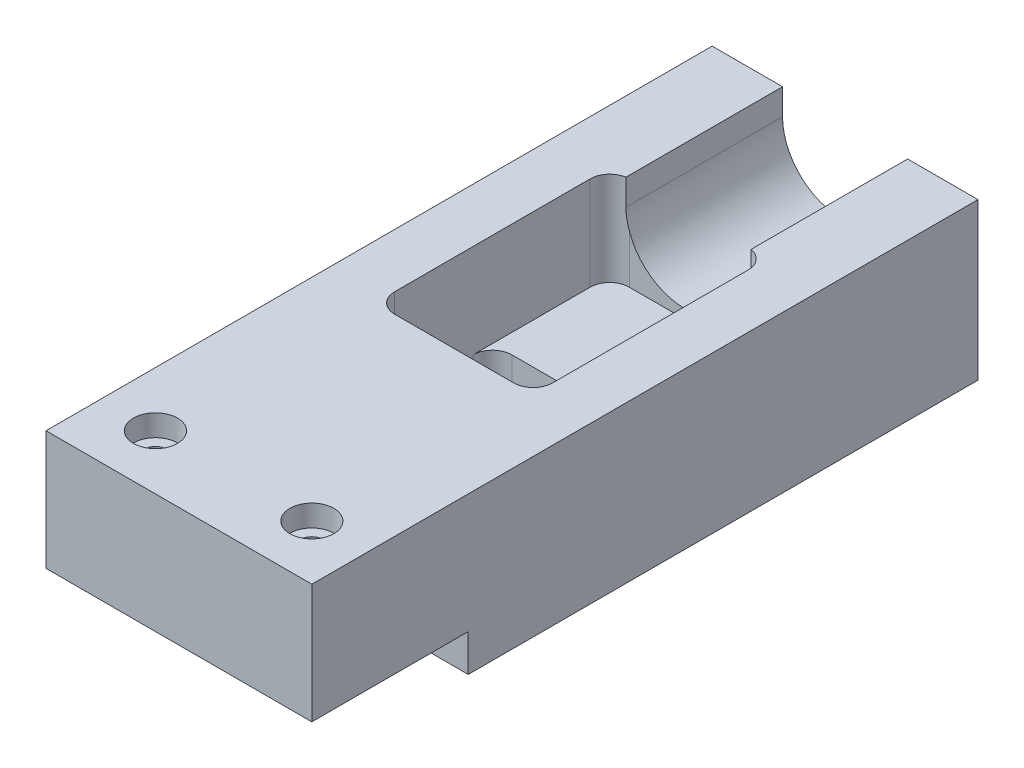
from build123d import *

# Parameters (mm, degrees)
BASE_DEPTH                   = 12.7
BASE_DEPTH_BACK              = 12.7
SKETCH1_W                    = 43.18
SKETCH1_H                    = 108.204
ACTUATORPLANECUT_DEPTH       = 6.0325
CENTERSLOT_DEPTH             = 60.619162222
CENTERSLOT_DEPTH_BACK        = 60.619162222
SKETCH5_W                    = 25.654
SKETCH5_H                    = 19.05
SHAFTGUIDE_REACH             = 113.065
SKETCH2_R                    = 4.7625
CENTERSLOTFILLET_R           = 3.175
GEARBOXPIT_DEPTH             = 11.176
FRONTCUTAWAY_DEPTH           = 15.24
GEARBOXSLOTSH_DEPTH          = 2.286
TOGGLEASSEMHOLES_D           = 2.7051
TOGGLEASSEMHOLES_DEPTH       = 9.398
TOGGLEASSEMHOLES_TIP         = 0.81269403
GEARBOXMOUNTINGHOLES_D       = 2.7051
GEARBOXMOUNTINGHOLES_DEPTH   = 9.398
GEARBOXMOUNTINGHOLES_TIP     = 0.81269403
CAPMOUNTINGHOLES_D           = 3.6576
CAPMOUNTINGHOLES_CBORE_D     = 7.14502
CAPMOUNTINGHOLES_CBORE_DEPTH = 3.5052
ROLLMOTORSLOT_REACH          = 113.065


with BuildPart() as part:
    # Sketch1 → Base (new, two sides: drawn at the far end of the back side and taken through both)
    with BuildSketch(Plane(origin=(0, 0, 0), x_dir=(1, 0, 0), z_dir=(0, 1, 0)).offset(-BASE_DEPTH_BACK)):
        Rectangle(SKETCH1_W, SKETCH1_H)
    extrude(amount=BASE_DEPTH + BASE_DEPTH_BACK)

    # Sketch3 → ActuatorPlaneCut (cut)
    with BuildSketch(Plane(origin=(0, -12.7, 0), x_dir=(-1, 0, 0), z_dir=(0, -1, 0))):
        Polygon((10.922, -28.702), (16.256, -28.702), (21.59, -28.702), (21.59, -54.102), (-21.59, -54.102), (-21.59, -28.702), (-10.922, -28.702), (-10.922, -11.176), (10.922, -11.176), align=None)
    extrude(amount=-ACTUATORPLANECUT_DEPTH, mode=Mode.SUBTRACT)

    # Sketch5 → CenterSlot (cut, two sides: drawn at the far end of the back side and taken through both)
    with BuildSketch(Plane(origin=(0, 0, 0), x_dir=(1, 0, 0), z_dir=(0, 1, 0)).offset(-CENTERSLOT_DEPTH_BACK)):
        with Locations((0, 0.127)):
            Rectangle(SKETCH5_W, SKETCH5_H)
    extrude(amount=CENTERSLOT_DEPTH + CENTERSLOT_DEPTH_BACK, mode=Mode.SUBTRACT)

    # Sketch2 → ShaftGuide (cut, up to next)
    with BuildSketch(Plane(origin=(0, 0, -54.102), x_dir=(-1, 0, 0), z_dir=(0, 0, -1)), mode=Mode.PRIVATE) as shaftguide_sk1:
        with Locations((0, -12.7)):
            Circle(SKETCH2_R)
    shaftguide_tool1 = extrude(shaftguide_sk1.sketch, amount=-SHAFTGUIDE_REACH, mode=Mode.PRIVATE) & part.part
    add(shaftguide_tool1.solids().sort_by_distance((0, -12.7, -54.102))[0], mode=Mode.SUBTRACT)

    # CenterSlotFillet
    centerslotfillet_edges = [part.edges().sort_by_distance(p)[0] for p in [
        (-12.827, 0, -9.652),
        (-12.827, 0, 9.398),
        (12.827, 0, 9.398),
        (12.827, 0, -9.652),
    ]]
    fillet(centerslotfillet_edges, radius=CENTERSLOTFILLET_R)

    # Sketch40 → GearBoxPit (cut)
    with BuildSketch(Plane.XZ.offset(12.7)):
        with BuildLine():
            Line((10.922, 6.858), (-10.922, 6.858))
            Line((-10.922, 6.858), (-10.922, 25.527))
            ThreePointArc((-10.922, 25.527), (-9.99206403, 27.77206403), (-7.747, 28.702))
            Line((-7.747, 28.702), (7.747, 28.702))
            ThreePointArc((7.747, 28.702), (9.99206403, 27.77206403), (10.922, 25.527))
            Line((10.922, 25.527), (10.922, 6.858))
        make_face()
    extrude(amount=-GEARBOXPIT_DEPTH, mode=Mode.SUBTRACT)

    # Sketch60 → FrontCutaway (cut)
    with BuildSketch(Plane(origin=(0, 12.7, 0), x_dir=(1, 0, 0), z_dir=(0, 1, 0))):
        with BuildLine():
            Line((-12.827, 6.477), (12.827, 6.477))
            Line((12.827, 6.477), (12.827, 25.527))
            ThreePointArc((12.827, 25.527), (11.89706403, 27.77206403), (9.652, 28.702))
            Line((9.652, 28.702), (-9.652, 28.702))
            ThreePointArc((-9.652, 28.702), (-11.89706403, 27.77206403), (-12.827, 25.527))
            Line((-12.827, 25.527), (-12.827, 6.477))
        make_face()
    extrude(amount=-FRONTCUTAWAY_DEPTH, mode=Mode.SUBTRACT)

    # Sketch67 → GearBoxSlotsH (cut)
    with BuildSketch(Plane(origin=(0, -12.7, 0), x_dir=(-1, 0, 0), z_dir=(0, -1, 0))):
        with BuildLine():
            Line((-12.3825, -12.811125), (12.3825, -12.811125))
            ThreePointArc((12.3825, -12.811125), (12.779375, -13.208), (12.3825, -13.604875))
            Line((12.3825, -13.604875), (-12.3825, -13.604875))
            ThreePointArc((-12.3825, -13.604875), (-12.779375, -13.208), (-12.3825, -12.811125))
        make_face()
        with BuildLine():
            Line((-12.3825, -23.479125), (12.3825, -23.479125))
            ThreePointArc((12.3825, -23.479125), (12.779375, -23.876), (12.3825, -24.272875))
            Line((12.3825, -24.272875), (-12.3825, -24.272875))
            ThreePointArc((-12.3825, -24.272875), (-12.779375, -23.876), (-12.3825, -23.479125))
        make_face()
    extrude(amount=-GEARBOXSLOTSH_DEPTH, mode=Mode.SUBTRACT)

    # ToggleAssemHoles
    with Locations(Plane(origin=(0, -12.7, 0), x_dir=(-1, 0, 0), z_dir=(0, -1, 0))):
        with Locations((15.875, 22.352), (-15.875, 22.352)):
            Hole(TOGGLEASSEMHOLES_D / 2, depth=TOGGLEASSEMHOLES_DEPTH)
            with Locations((0, 0, -(TOGGLEASSEMHOLES_DEPTH + TOGGLEASSEMHOLES_TIP / 2))):  # 118° drill point
                Cone(0, TOGGLEASSEMHOLES_D / 2, TOGGLEASSEMHOLES_TIP, mode=Mode.SUBTRACT)

    # GearBoxMountingHoles
    with Locations(Plane(origin=(0, -12.7, 0), x_dir=(-1, 0, 0), z_dir=(0, -1, 0))):
        with Locations((-16.256, -18.542), (16.256, -18.542)):
            Hole(GEARBOXMOUNTINGHOLES_D / 2, depth=GEARBOXMOUNTINGHOLES_DEPTH)
            with Locations((0, 0, -(GEARBOXMOUNTINGHOLES_DEPTH + GEARBOXMOUNTINGHOLES_TIP / 2))):  # 118° drill point
                Cone(0, GEARBOXMOUNTINGHOLES_D / 2, GEARBOXMOUNTINGHOLES_TIP, mode=Mode.SUBTRACT)

    # CapMountingHoles (through all)
    with Locations(Plane(origin=(-0.837932951, 12.7, 8.633720573), x_dir=(-1, 0, 0), z_dir=(0, 1, 0))):
        with Locations((-13.537932951, 36.578279427), (11.862067049, 36.578279427)):
            CounterBoreHole(CAPMOUNTINGHOLES_D / 2, CAPMOUNTINGHOLES_CBORE_D / 2, CAPMOUNTINGHOLES_CBORE_DEPTH)

    # Sketch81 → RollMotorSlot (cut, up to next)
    with BuildSketch(Plane(origin=(0, 0, -54.102), x_dir=(-1, 0, 0), z_dir=(0, 0, -1)), mode=Mode.PRIVATE) as rollmotorslot_sk1:
        with BuildLine():
            Line((10.16, 12.7), (-10.16, 12.7))
            Line((-10.16, 12.7), (-10.16, 8.46582))
            ThreePointArc((-10.16, 8.46582), (-7.370192091, 1.730627909), (-0.635, -1.05918))
            Line((-0.635, -1.05918), (0.635, -1.05918))
            ThreePointArc((0.635, -1.05918), (7.370192091, 1.730627909), (10.16, 8.46582))
            Line((10.16, 8.46582), (10.16, 12.7))
        make_face()
    rollmotorslot_tool1 = extrude(rollmotorslot_sk1.sketch, amount=-ROLLMOTORSLOT_REACH, mode=Mode.PRIVATE) & part.part
    add(rollmotorslot_tool1.solids().sort_by_distance((0, 6.589347, -54.102))[0], mode=Mode.SUBTRACT)


solid = part.part
